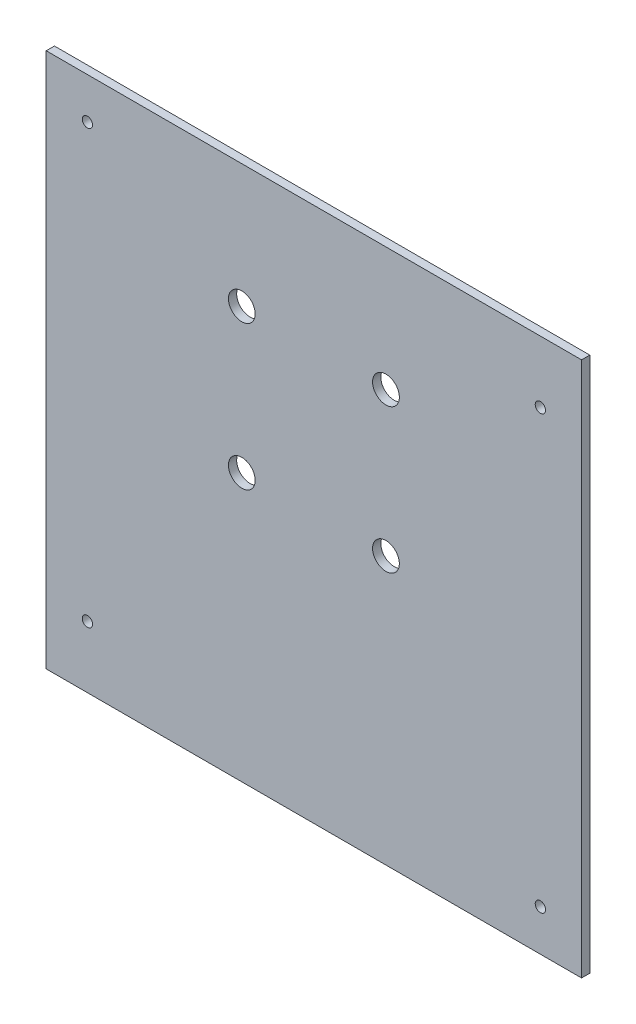
from build123d import *

# Parameters (mm, degrees)
SKETCH_1_W      = 130
SKETCH_1_H      = 130
SKETCH_1_R      = 1.25
SKETCH_1_R_2    = 3.25
EXTRUDE_1_DEPTH = 2


with BuildPart() as part:
    # Эскиз1 → Бобышка-Вытянуть1 (new body)
    with BuildSketch(Plane.XY):
        with Locations((0, -17.5)):
            Rectangle(SKETCH_1_W, SKETCH_1_H)
        with Locations((-55, 37.5)):
            Circle(SKETCH_1_R, mode=Mode.SUBTRACT)
        with Locations((55, 32.5)):
            Circle(SKETCH_1_R, mode=Mode.SUBTRACT)
        with Locations((55, -72.5)):
            Circle(SKETCH_1_R, mode=Mode.SUBTRACT)
        with Locations((-55, -67.5)):
            Circle(SKETCH_1_R, mode=Mode.SUBTRACT)
        with Locations((-17.5, 17.5)):
            Circle(SKETCH_1_R_2, mode=Mode.SUBTRACT)
        with Locations((17.5, 17.5)):
            Circle(SKETCH_1_R_2, mode=Mode.SUBTRACT)
        with Locations((-17.5, -17.5)):
            Circle(SKETCH_1_R_2, mode=Mode.SUBTRACT)
        with Locations((17.5, -17.5)):
            Circle(SKETCH_1_R_2, mode=Mode.SUBTRACT)
    extrude(amount=EXTRUDE_1_DEPTH)


solid = part.part
